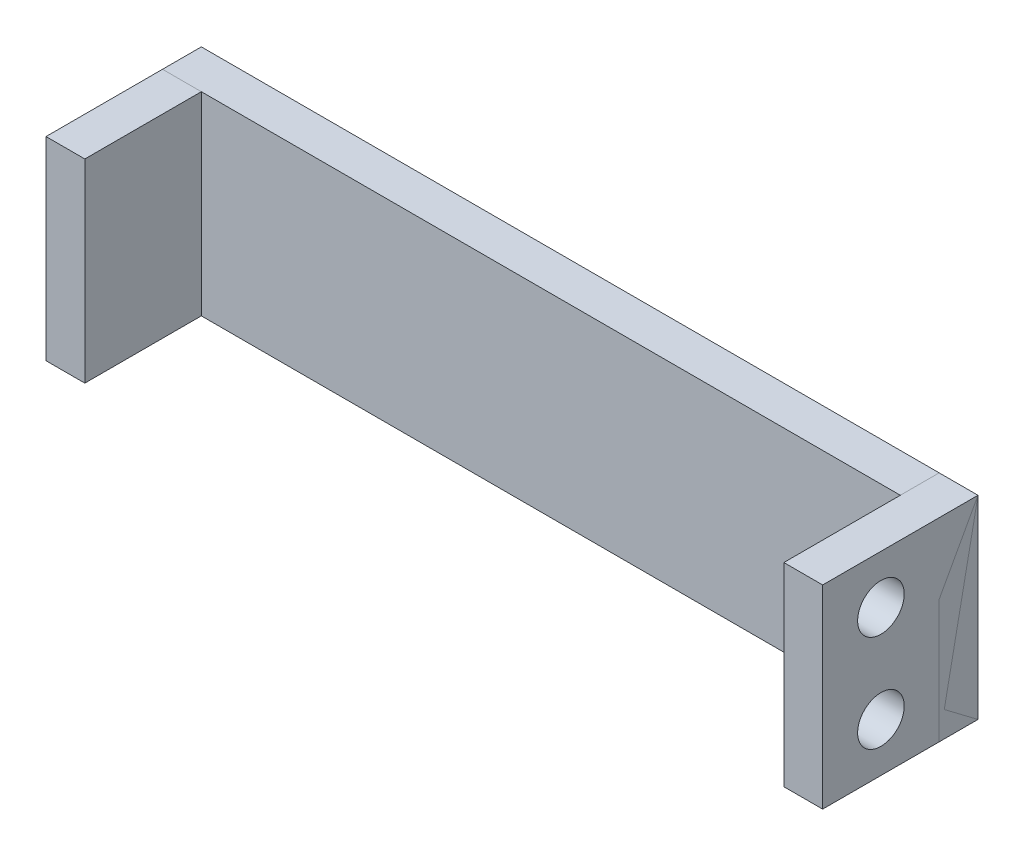
from build123d import *

# Parameters (mm, degrees)
SKETCH2_W           = 10.16
SKETCH2_H           = 12.7
SKETCH2_R           = 1.524
BOSS_EXTRUDE2_DEPTH = 2.54
SKETCH3_W           = 2.54
SKETCH3_H           = 12.7
BOSS_EXTRUDE3_DEPTH = 50.8
SKETCH4_W           = 10.16
SKETCH4_H           = 12.7
BOSS_EXTRUDE4_DEPTH = 2.54


with BuildPart() as part:
    # Sketch2 → Boss-Extrude2 (new body)
    with BuildSketch(Plane(origin=(0, 0, 0), x_dir=(0, 0, -1), z_dir=(1, 0, 0))):
        with Locations((5.08, 6.35)):
            Rectangle(SKETCH2_W, SKETCH2_H)
        with Locations((3.81, 9.525)):
            Circle(SKETCH2_R, mode=Mode.SUBTRACT)
        with Locations((3.81, 3.175)):
            Circle(SKETCH2_R, mode=Mode.SUBTRACT)
    extrude(amount=BOSS_EXTRUDE2_DEPTH)


with BuildPart() as body_2:
    # Sketch3 → Boss-Extrude3 (new body)
    with BuildSketch(Plane(origin=(2.54, 0, 0), x_dir=(0, 0, -1), z_dir=(1, 0, 0))):
        with Locations((8.89, 6.35)):
            Rectangle(SKETCH3_W, SKETCH3_H)
    extrude(amount=-BOSS_EXTRUDE3_DEPTH)


with BuildPart() as body_3:
    # Sketch4 → Boss-Extrude4 (new body)
    with BuildSketch(Plane.ZY.offset(48.26)):
        with Locations((-5.08, 6.35)):
            Rectangle(SKETCH4_W, SKETCH4_H)
    extrude(amount=-BOSS_EXTRUDE4_DEPTH)


solid = Compound([part.part, body_2.part, body_3.part])
